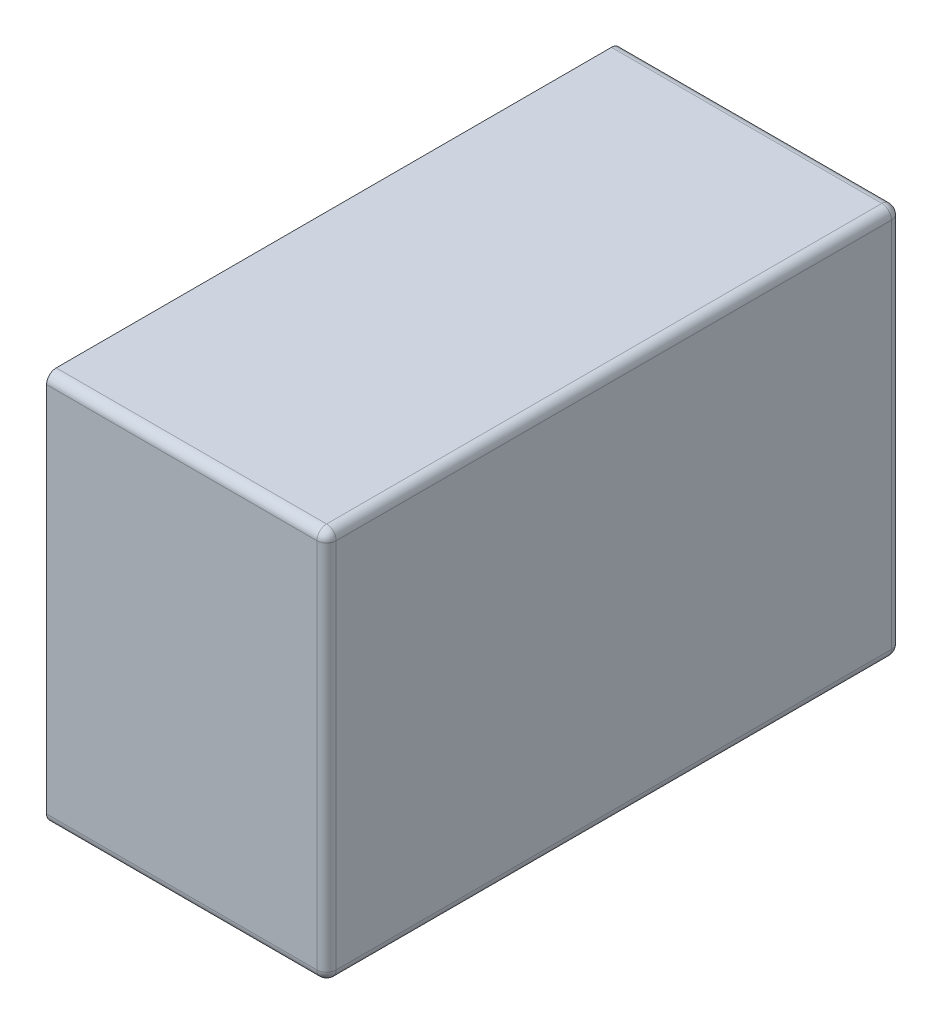
from build123d import *

# Parameters (mm, degrees)
SKETCH1_W           = 290
SKETCH1_H           = 595
BOSS_EXTRUDE2_DEPTH = 405
FILLET3_R           = 10
SKETCH3_W           = 575
SKETCH3_H           = 385
CUT_EXTRUDE2_DEPTH  = 270


with BuildPart() as part:
    # Sketch1 → Boss-Extrude2 (new body)
    with BuildSketch(Plane(origin=(0, 0, 0), x_dir=(1, 0, 0), z_dir=(0, 1, 0))):
        Rectangle(SKETCH1_W, SKETCH1_H)
    extrude(amount=BOSS_EXTRUDE2_DEPTH)

    # Fillet3
    fillet3_edges = [part.edges().sort_by_distance(p)[0] for p in [
        (0, 405, 297.5),
        (145, 405, 0),
        (0, 0, 297.5),
        (0, 0, -297.5),
        (145, 0, 0),
        (145, 202.5, 297.5),
        (145, 202.5, -297.5),
        (0, 405, -297.5),
    ]]
    fillet(fillet3_edges, radius=FILLET3_R)

    # Sketch3 → Cut-Extrude2 (cut)
    with BuildSketch(Plane.ZY.offset(145)):
        with Locations((0, 202.5)):
            Rectangle(SKETCH3_W, SKETCH3_H)
    extrude(amount=-CUT_EXTRUDE2_DEPTH, mode=Mode.SUBTRACT)


solid = part.part
